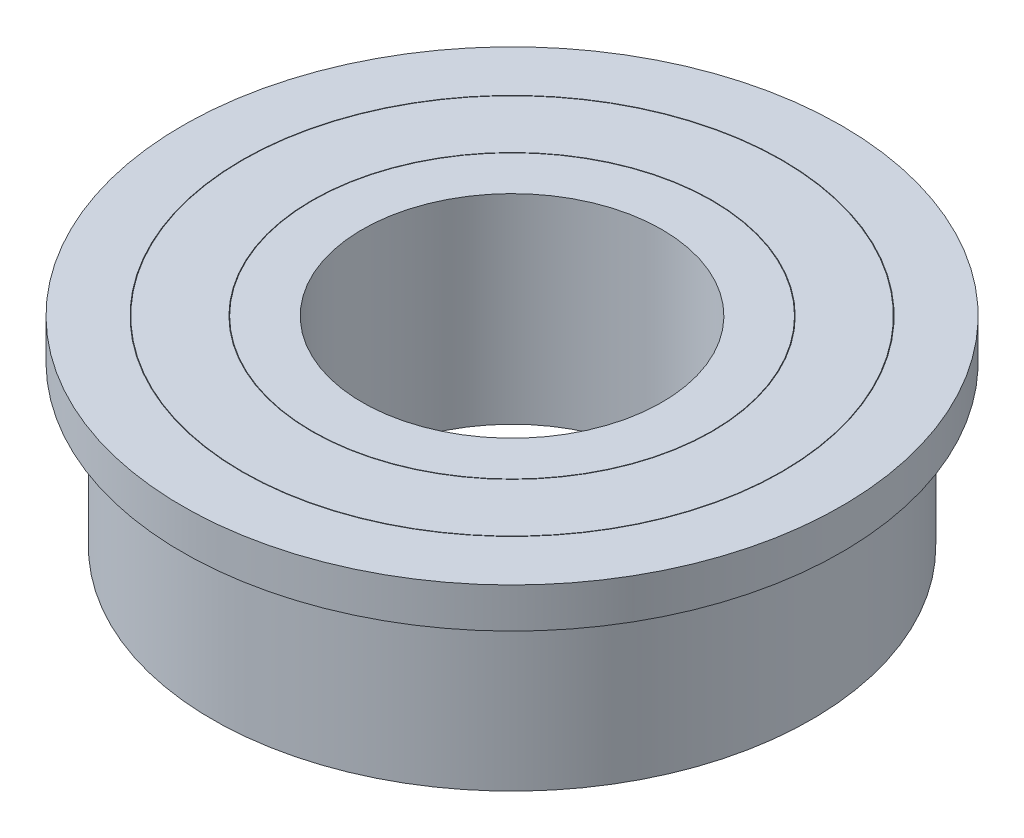
from build123d import *

# Parameters (mm, degrees)
SKETCH_1_W   = 1
SKETCH_1_H   = 4
SKETCH_1_W_2 = 1.39


with BuildPart() as part:
    # 草图1 → 旋转1 (revolve)
    with BuildSketch(Plane(origin=(0, 0, 0), x_dir=(0, 0, -1), z_dir=(1, 0, 0)), mode=Mode.PRIVATE) as revolve_1_sk:
        with Locations((-3.5, 2)):
            Rectangle(SKETCH_1_W, SKETCH_1_H)
        Polygon((-6, 0), (-6, 3.2), (-6.6, 3.2), (-6.6, 4), (-5.41, 4), (-5.41, 0), align=None)
        with Locations((-4.705, 2)):
            Rectangle(SKETCH_1_W_2, SKETCH_1_H)
    revolve(revolve_1_sk.sketch.rotate(Axis((0, 0, 0), (0, 1, 0)), 180), axis=Axis((0, 0, 0), (0, 1, 0)))


solid = part.part
